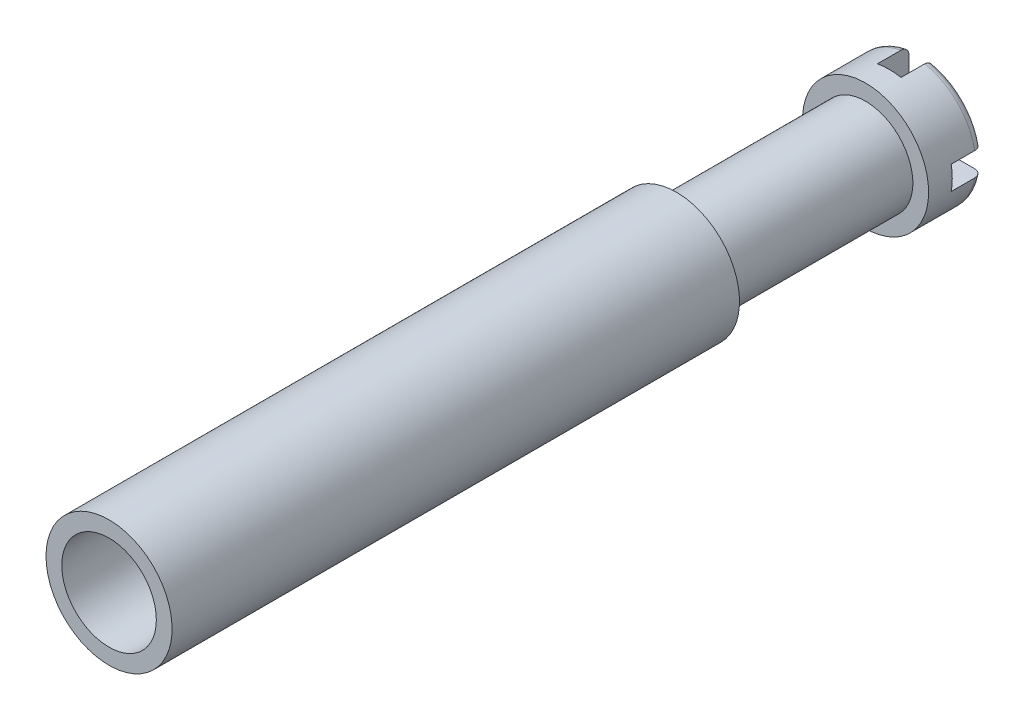
from build123d import *

# Parameters (mm, degrees)
SKETCH1_R           = 3
BOSS_EXTRUDE1_DEPTH = 12
BOSS_EXTRUDE2_START = -3.5
SKETCH1_4_R         = 4
SKETCH1_4_R_2       = 3
BOSS_EXTRUDE2_DEPTH = 3.5
CUT_EXTRUDE1_DEPTH  = 2
FILLET1_R           = 0.5
CUT_EXTRUDE2_START  = -2
SKETCH2_3_R         = 1.25
CUT_EXTRUDE2_DEPTH  = 1
CUT_EXTRUDE2_DRAFT  = -20
FILLET2_R           = 0.5
BOSS_EXTRUDE3_START = 12
SKETCH1_5_R         = 4
BOSS_EXTRUDE3_DEPTH = 36
CUT_EXTRUDE3_START  = -20
SKETCH9_R           = 3
CUT_EXTRUDE3_DEPTH  = 20


with BuildPart() as part:
    # Sketch1 → Boss-Extrude1 (new body)
    with BuildSketch(Plane.XY):
        Circle(SKETCH1_R)
    extrude(amount=BOSS_EXTRUDE1_DEPTH)

    # Sketch1<4> → Boss-Extrude2 (add)
    # profile 1 of 2: a face of its own
    with BuildSketch(Plane.XY.offset(BOSS_EXTRUDE2_START)):
        Circle(SKETCH1_4_R)
        Circle(SKETCH1_4_R_2, mode=Mode.SUBTRACT)
    # profile 2 of 2: a face of its own
    with BuildSketch(Plane.XY.offset(BOSS_EXTRUDE2_START)):
        Circle(SKETCH1_4_R_2)
    extrude(amount=BOSS_EXTRUDE2_DEPTH)

    # Sketch2 → Cut-Extrude1 (cut)
    with BuildSketch(Plane(origin=(0, 0, -3.5), x_dir=(-1, 0, 0), z_dir=(0, 0, -1))):
        with BuildLine():
            ThreePointArc((0.75, 3.929058411), (0, 4), (-0.75, 3.929058411))
            Line((-0.75, 3.929058411), (-0.75, 1))
            ThreePointArc((-0.75, 1), (0, 1.25), (0.75, 1))
            Line((0.75, 1), (0.75, 3.929058411))
        make_face()
        with BuildLine():
            Line((-1, 0.75), (-3.929058411, 0.75))
            ThreePointArc((-3.929058411, 0.75), (-4, 0), (-3.929058411, -0.75))
            Line((-3.929058411, -0.75), (-1, -0.75))
            ThreePointArc((-1, -0.75), (-1.25, 0), (-1, 0.75))
        make_face()
        with BuildLine():
            ThreePointArc((4, 0), (3.98222511, 0.376673834), (3.929058411, 0.75))
            Line((3.929058411, 0.75), (1, 0.75))
            ThreePointArc((1, 0.75), (1.185854123, 0.395284708), (1.25, 0))
            ThreePointArc((1.25, 0), (1.185854123, -0.395284708), (1, -0.75))
            Line((1, -0.75), (3.929058411, -0.75))
            ThreePointArc((3.929058411, -0.75), (3.98222511, -0.376673834), (4, 0))
        make_face()
        with BuildLine():
            Line((-0.75, -1), (-0.75, -3.929058411))
            ThreePointArc((-0.75, -3.929058411), (0, -4), (0.75, -3.929058411))
            Line((0.75, -3.929058411), (0.75, -1))
            ThreePointArc((0.75, -1), (0, -1.25), (-0.75, -1))
        make_face()
        with BuildLine():
            ThreePointArc((0.75, 1), (0, 1.25), (-0.75, 1))
            Line((-0.75, 1), (-0.75, 0.75))
            Line((-0.75, 0.75), (-1, 0.75))
            ThreePointArc((-1, 0.75), (-1.25, 0), (-1, -0.75))
            Line((-1, -0.75), (-0.75, -0.75))
            Line((-0.75, -0.75), (-0.75, -1))
            ThreePointArc((-0.75, -1), (0, -1.25), (0.75, -1))
            Line((0.75, -1), (0.75, -0.75))
            Line((0.75, -0.75), (1, -0.75))
            ThreePointArc((1, -0.75), (1.185854123, -0.395284708), (1.25, 0))
            ThreePointArc((1.25, 0), (1.185854123, 0.395284708), (1, 0.75))
            Line((1, 0.75), (0.75, 0.75))
            Line((0.75, 0.75), (0.75, 1))
        make_face()
        with BuildLine():
            Line((-0.75, 0.75), (-0.75, 1))
            ThreePointArc((-0.75, 1), (-0.883883476, 0.883883476), (-1, 0.75))
            Line((-1, 0.75), (-0.75, 0.75))
        make_face()
        with BuildLine():
            ThreePointArc((1, 0.75), (0.883883476, 0.883883476), (0.75, 1))
            Line((0.75, 1), (0.75, 0.75))
            Line((0.75, 0.75), (1, 0.75))
        make_face()
        with BuildLine():
            ThreePointArc((0.75, -1), (0.883883476, -0.883883476), (1, -0.75))
            Line((1, -0.75), (0.75, -0.75))
            Line((0.75, -0.75), (0.75, -1))
        make_face()
        with BuildLine():
            Line((-0.75, -0.75), (-1, -0.75))
            ThreePointArc((-1, -0.75), (-0.883883476, -0.883883476), (-0.75, -1))
            Line((-0.75, -1), (-0.75, -0.75))
        make_face()
    extrude(amount=-CUT_EXTRUDE1_DEPTH, mode=Mode.SUBTRACT)

    # Fillet1
    fillet1_edges = [part.edges().sort_by_distance(p)[0] for p in [
        (-2.828427125, 2.828427125, -3.5),
        (-2.828427125, -2.828427125, -3.5),
        (2.828427125, -2.828427125, -3.5),
        (2.828427125, 2.828427125, -3.5),
    ]]
    fillet(fillet1_edges, radius=FILLET1_R)


with BuildPart() as cut_extrude2_tool:
    # Sketch2<3> → Cut-Extrude2 (with draft: the straight prism first)
    with BuildSketch(Plane(origin=(0, 0, -3.5), x_dir=(-1, 0, 0), z_dir=(0, 0, -1)).offset(CUT_EXTRUDE2_START)):
        Circle(SKETCH2_3_R)
    extrude(amount=-CUT_EXTRUDE2_DEPTH)
    # Cut-Extrude2: the draft: its side faces are tilted about the plane it starts from
    cut_extrude2_sides = [cut_extrude2_tool.faces().sort_by_distance(p)[0] for p in [
        (1.25, 0, -1),
    ]]
    draft(cut_extrude2_sides, Plane(origin=(0, 0, -3.5), x_dir=(-1, 0, 0), z_dir=(0, 0, -1)).offset(CUT_EXTRUDE2_START), CUT_EXTRUDE2_DRAFT)


with BuildPart() as part_1:
    add(part.part)

    # Cut-Extrude2: cut by cut_extrude2_tool
    add(cut_extrude2_tool.part, mode=Mode.SUBTRACT)

    # Fillet2
    fillet2_edges = [part_1.edges().sort_by_distance(p)[0] for p in [
        (0.886029766, 0, -0.5),
    ]]
    fillet(fillet2_edges, radius=FILLET2_R)

    # Sketch1<5> → Boss-Extrude3 (add)
    with BuildSketch(Plane.XY.offset(BOSS_EXTRUDE3_START)):
        Circle(SKETCH1_5_R)
    extrude(amount=BOSS_EXTRUDE3_DEPTH)

    # Sketch9 → Cut-Extrude3 (cut)
    with BuildSketch(Plane.XY.offset(48).offset(CUT_EXTRUDE3_START)):
        with Locations(Location((0, 0, 0), (0, 0, 180))):
            Circle(SKETCH9_R)
    extrude(amount=CUT_EXTRUDE3_DEPTH, mode=Mode.SUBTRACT)


solid = part_1.part
